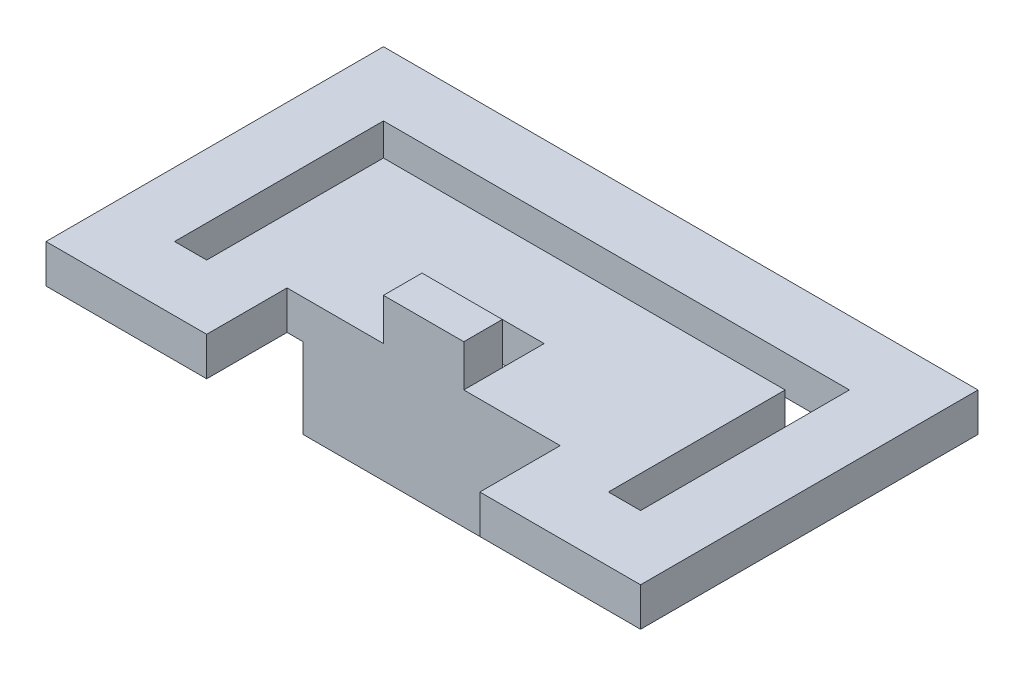
from build123d import *

# Parameters (mm, degrees)
BOSS_EXTRUDE1_DEPTH = 0.24
BOSS_EXTRUDE2_DEPTH = 0.24
BOSS_EXTRUDE3_DEPTH = 0.24


with BuildPart() as part:
    # Sketch2 → Boss-Extrude1 (new body)
    with BuildSketch(Plane.XY):
        Polygon((0, 0), (0, 0.5), (0.5, 0.5), (0.5, 1), (1, 1), (1, 0.5), (1.5, 0.5), (1.5, 0), align=None)
    extrude(amount=BOSS_EXTRUDE1_DEPTH)

    # Sketch3 → Boss-Extrude2 (add)
    with BuildSketch(Plane(origin=(0, 0.5, 0), x_dir=(1, 0, 0), z_dir=(0, 1, 0))):
        Polygon((0.5, -0.24), (0.5, 0.26), (1, 0.26), (1, -0.24), (2, -0.24), (2, 0.76), (-0.5, 0.76), (-0.5, -0.24), align=None)
    extrude(amount=BOSS_EXTRUDE2_DEPTH)

    # Sketch4 → Boss-Extrude3 (add)
    with BuildSketch(Plane(origin=(0, 0.74, 0), x_dir=(1, 0, 0), z_dir=(0, 1, 0))):
        Polygon((-0.1, -0.24), (-0.1, -0.74), (-1.1, -0.74), (-1.1, 1.36), (2.6, 1.36), (2.6, -0.74), (1.6, -0.74), (1.6, -0.24), (2, -0.24), (2, -0.34), (2.2, -0.34), (2.2, 0.96), (-0.7, 0.96), (-0.7, -0.34), (-0.5, -0.34), (-0.5, -0.24), align=None)
    extrude(amount=-BOSS_EXTRUDE3_DEPTH)


solid = part.part
